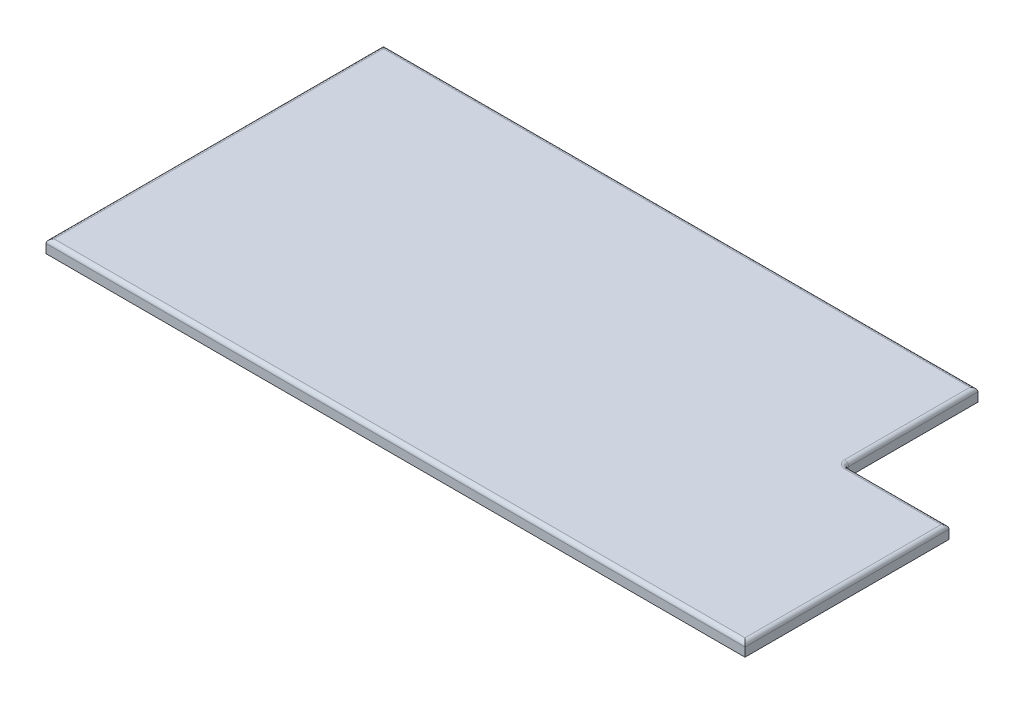
from build123d import *

# Parameters (mm, degrees)
SKETCH_55_W         = 87
SKETCH_55_H         = 42
EXTRUDE_1_DEPTH     = 1.6
SKETCH_56_W         = 13
SKETCH_56_H         = 16.6
CUT_EXTRUDE_1_DEPTH = 1.6
FILLET_1_R          = 0.5


with BuildPart() as part:
    # Эскиз55 → Бобышка-Вытянуть1 (new body)
    with BuildSketch(Plane(origin=(0, 0, 0), x_dir=(1, 0, 0), z_dir=(0, 1, 0))):
        with Locations((43.5, 21)):
            Rectangle(SKETCH_55_W, SKETCH_55_H)
    extrude(amount=EXTRUDE_1_DEPTH)

    # Эскиз56 → Вырез-Вытянуть1 (cut)
    with BuildSketch(Plane(origin=(0, 1.6, 0), x_dir=(1, 0, 0), z_dir=(0, 1, 0))):
        with Locations((80.5, 33.7)):
            Rectangle(SKETCH_56_W, SKETCH_56_H)
    extrude(amount=-CUT_EXTRUDE_1_DEPTH, mode=Mode.SUBTRACT)

    # Скругление1
    fillet_1_edges = [part.edges().sort_by_distance(p)[0] for p in [
        (87, 1.6, -12.7),
        (37, 1.6, -42),
        (74, 0.8, -25.4),
        (74, 1.6, -33.7),
        (80.5, 1.6, -25.4),
        (0, 1.6, -21),
        (43.5, 1.6, 0),
    ]]
    fillet(fillet_1_edges, radius=FILLET_1_R)


solid = part.part
